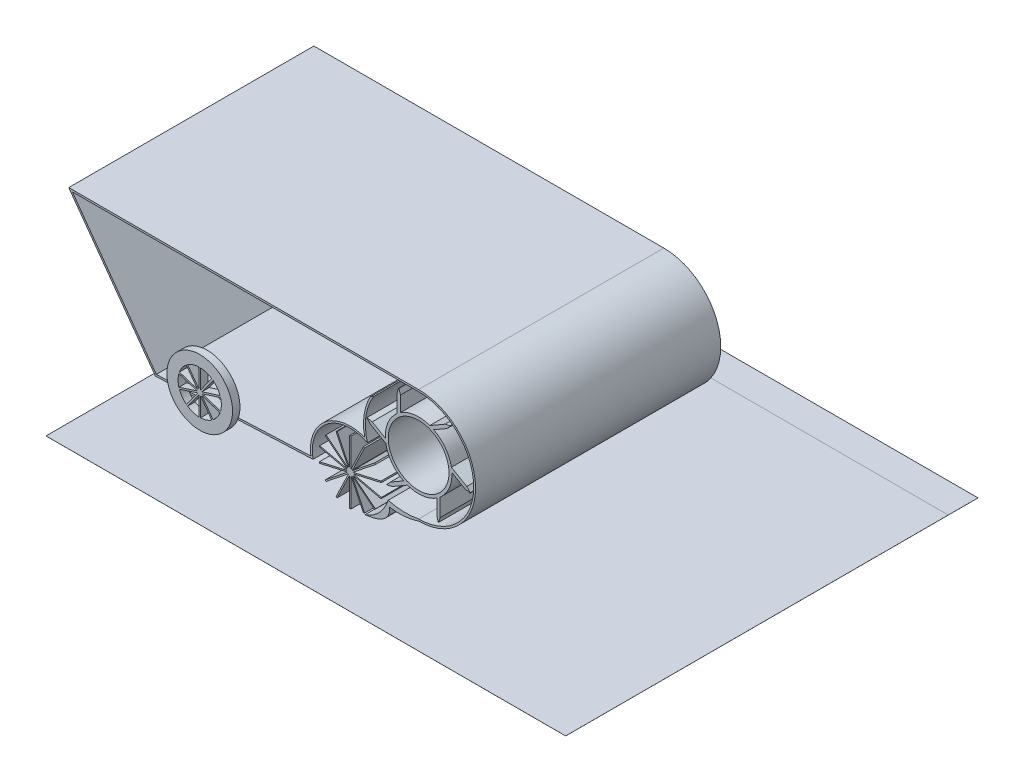
from build123d import *
from build123d.topology import SkipClean

# Parameters (mm, degrees)
BOSS_EXTRUDE1_DEPTH      = 65
SKETCH1_R                = 8.504839871
BOSS_EXTRUDE1_2_DEPTH    = 65
BOSS_EXTRUDE1_3_DEPTH    = 65
SKETCH1_R_2              = 14
BOSS_EXTRUDE1_4_DEPTH    = 65
SKETCH2_R                = 8.840643749
BOSS_EXTRUDE2_DEPTH      = 2
BOSS_EXTRUDE4_START      = 1
BOSS_EXTRUDE4_DEPTH      = 1
LPATTERN2_COUNT          = 2
LPATTERN2_PITCH          = 68
CUT_EXTRUDE1_START       = -65
CUT_EXTRUDE1_DEPTH       = 65
CUT_EXTRUDE7_START       = -65
CUT_EXTRUDE7_DEPTH       = 65
BOSS_EXTRUDE5_DEPTH      = 24
BOSS_EXTRUDE5_DEPTH_BACK = 79
SKETCH7_W                = 139.893797987
SKETCH7_H                = 0.01
SKETCH8_R                = 8.966255543
BOSS_EXTRUDE6_DEPTH      = 65
SKETCH9_R                = 8.174403451
CUT_EXTRUDE8_DEPTH       = 65
BOSS_EXTRUDE9_DEPTH      = 69
BOSS_EXTRUDE9_DEPTH_BACK = 22


with BuildPart() as part:
    # Sketch1 → Boss-Extrude1 (new body)
    with BuildSketch(Plane.XY):
        with BuildLine():
            ThreePointArc((-17.906870328, 18.531590113), (-28.480107725, 16.903769153), (-32.409642579, 6.953799004))
            Line((-32.409642579, 6.953799004), (-74.016578716, 5.184721568))
            Line((-74.016578716, 5.184721568), (-96.612999837, 36.459014216))
            Line((-96.612999837, 36.459014216), (-3.402015231, 36.459014216))
            ThreePointArc((-3.402015231, 36.459014216), (11.429545435, 21.62745355), (-3.402015231, 6.795892884))
            add(Edge.make_bspline(
                [(-11.616963472, 7.038658703), (-7.573695669, 5.998539104), (-3.402015231, 6.795892884)],
                knots=[0, 0, 0, 1, 1, 1], degree=2))
            add(Edge.make_bspline(
                [(-17.830159316, 0.566712563), (-13.289143095, 2.179337105), (-11.616963472, 7.038658703)],
                knots=[0, 0, 0, 1, 1, 1], degree=2))
            add(Edge.make_bspline(
                [(-17.830159316, 0.566712563), (-13.144144962, 1.095751607), (-10.950814866, 2.792448163), (-11.250167045, 5.656783258)],
                knots=[0, 0, 0, 0, 0.910766235, 0.910766235, 0.910766235, 0.910766235], degree=3))
            add(Edge.make_bspline(
                [(-11.250167045, 5.656783258), (-7.302874817, 4.995855134), (-3.409462759, 6.295894693)],
                knots=[0, 0, 0, 1, 1, 1], degree=2))
            ThreePointArc((-3.409462759, 6.295894693), (11.929544982, 21.623729786), (-3.402015231, 36.959014216))
            Line((-3.402015231, 36.959014216), (-97.591116803, 36.959014216))
            Line((-97.591116803, 36.959014216), (-74.264237184, 4.673739667))
            Line((-74.264237184, 4.673739667), (-31.819790944, 6.478427036))
            ThreePointArc((-31.819790944, 6.478427036), (-27.993437475, 16.649430984), (-17.173651213, 17.66063196))
            ThreePointArc((-17.173651213, 17.66063196), (-17.591195584, 23.642594253), (-15.524643386, 29.271766321))
            Line((-15.524643386, 29.271766321), (-16.399476015, 28.771766321))
            ThreePointArc((-16.399476015, 28.771766321), (-18.075448602, 23.787440797), (-17.906870328, 18.531590113))
        make_face()
    extrude(amount=BOSS_EXTRUDE1_DEPTH)

    # Sketch2 → Boss-Extrude2 (add)
    with BuildSketch(Plane.XY.offset(65)):
        with Locations((-60.327231595, 8.840643749)):
            Circle(SKETCH2_R)
        with BuildLine():
            Line((-65.802258736, 6.836721981), (-60.887402964, 8.433655426))
            Line((-60.887402964, 8.433655426), (-63.924950881, 4.25282939))
            ThreePointArc((-63.924950881, 4.25282939), (-65.043989715, 5.41371838), (-65.802258736, 6.836721981))
        make_face(mode=Mode.SUBTRACT)
        with BuildLine():
            Line((-63.578745936, 4.001296774), (-60.541198018, 8.18212281))
            Line((-60.541198018, 8.18212281), (-60.541198018, 3.014337627))
            ThreePointArc((-60.541198018, 3.014337627), (-62.12887288, 3.295762025), (-63.578745936, 4.001296774))
        make_face(mode=Mode.SUBTRACT)
        with BuildLine():
            Line((-60.113265172, 3.014337627), (-60.113265172, 8.18212281))
            Line((-60.113265172, 8.18212281), (-57.075717254, 4.001296774))
            ThreePointArc((-57.075717254, 4.001296774), (-58.52559031, 3.295762025), (-60.113265172, 3.014337627))
        make_face(mode=Mode.SUBTRACT)
        with BuildLine():
            Line((-56.729512309, 4.25282939), (-59.767060226, 8.433655426))
            Line((-59.767060226, 8.433655426), (-54.852204454, 6.836721981))
            ThreePointArc((-54.852204454, 6.836721981), (-55.610473475, 5.41371838), (-56.729512309, 4.25282939))
        make_face(mode=Mode.SUBTRACT)
        with BuildLine():
            Line((-54.719965932, 7.243710304), (-59.634821704, 8.840643749))
            Line((-59.634821704, 8.840643749), (-54.719965932, 10.437577193))
            ThreePointArc((-54.719965932, 10.437577193), (-54.496997925, 8.840643749), (-54.719965932, 7.243710304))
        make_face(mode=Mode.SUBTRACT)
        with BuildLine():
            Line((-65.934497259, 10.437577193), (-61.019641486, 8.840643749))
            Line((-61.019641486, 8.840643749), (-65.934497259, 7.243710304))
            ThreePointArc((-65.934497259, 7.243710304), (-66.157465265, 8.840643749), (-65.934497259, 10.437577193))
        make_face(mode=Mode.SUBTRACT)
        with BuildLine():
            Line((-63.924950881, 13.428458107), (-60.887402964, 9.247632071))
            Line((-60.887402964, 9.247632071), (-65.802258736, 10.844565516))
            ThreePointArc((-65.802258736, 10.844565516), (-65.043989715, 12.267569117), (-63.924950881, 13.428458107))
        make_face(mode=Mode.SUBTRACT)
        with BuildLine():
            Line((-60.541198018, 14.66694987), (-60.541198018, 9.499164687))
            Line((-60.541198018, 9.499164687), (-63.578745936, 13.679990723))
            ThreePointArc((-63.578745936, 13.679990723), (-62.12887288, 14.385525472), (-60.541198018, 14.66694987))
        make_face(mode=Mode.SUBTRACT)
        with BuildLine():
            Line((-59.767060226, 9.247632071), (-56.729512309, 13.428458107))
            ThreePointArc((-56.729512309, 13.428458107), (-55.610473475, 12.267569117), (-54.852204454, 10.844565516))
            Line((-54.852204454, 10.844565516), (-59.767060226, 9.247632071))
        make_face(mode=Mode.SUBTRACT)
        with BuildLine():
            Line((-57.075717254, 13.679990723), (-60.113265172, 9.499164687))
            Line((-60.113265172, 9.499164687), (-60.113265172, 14.66694987))
            ThreePointArc((-60.113265172, 14.66694987), (-58.52559031, 14.385525472), (-57.075717254, 13.679990723))
        make_face(mode=Mode.SUBTRACT)
    boss_extrude2 = extrude(amount=BOSS_EXTRUDE2_DEPTH)



with BuildPart() as body_2:
    # Sketch1 → Boss-Extrude1 2 (new body)
    with BuildSketch(Plane.XY):
        with Locations((-21.775110426, 8.504839871)):
            Circle(SKETCH1_R)
    extrude(amount=BOSS_EXTRUDE1_2_DEPTH)


with BuildPart() as body_3:
    # Sketch1 → Boss-Extrude1 3 (new body)
    with BuildSketch(Plane.XY):
        Polygon((-21.775110426, 0), (-79.709435336, 0), (-79.709435336, -0.01), (60.184362651, -0.01), (60.184362651, 0), align=None)
    extrude(amount=BOSS_EXTRUDE1_3_DEPTH)

    # Sketch7 → Boss-Extrude5 (add, two sides: drawn at the far end of the back side and taken through both)
    with BuildSketch(Plane.XY.offset(65).offset(-BOSS_EXTRUDE5_DEPTH_BACK)):
        with Locations((-9.762536342, -0.005)):
            Rectangle(SKETCH7_W, SKETCH7_H)
    extrude(amount=BOSS_EXTRUDE5_DEPTH + BOSS_EXTRUDE5_DEPTH_BACK)


with BuildPart() as body_4:
    # Sketch1 → Boss-Extrude1 4 (new body)
    with BuildSketch(Plane.XY):
        with Locations((-3.402015231, 21.62745355)):
            Circle(SKETCH1_R_2)
    extrude(amount=BOSS_EXTRUDE1_4_DEPTH)


with BuildPart() as part_1:
    with SkipClean():  # the faces are left unmerged after this step: merging them gives an invalid solid
        add(part.part)

        add(body_2.part)  # Boss-Extrude4 merges body 2

        add(body_4.part)  # Boss-Extrude4 merges body 4
        # Sketch3 → Boss-Extrude4 (add)
        with BuildSketch(Plane(origin=(0, 0, 0), x_dir=(-1, 0, 0), z_dir=(0, 0, -1)).offset(BOSS_EXTRUDE4_START)):
            with BuildLine():
                Line((74.264237184, 4.673739667), (97.591116803, 36.959014216))
                Line((97.591116803, 36.959014216), (3.402015231, 36.959014216))
                ThreePointArc((3.402015231, 36.959014216), (-11.929544982, 21.623729786), (3.409462759, 6.295894693))
                add(Edge.make_bspline(
                    [(11.250167045, 5.656783258), (7.302874817, 4.995855134), (3.409462759, 6.295894693)],
                    knots=[0, 0, 0, 1, 1, 1], degree=2))
                ThreePointArc((11.250167045, 5.656783258), (10.915878669, 7.523542115), (10.910103984, 9.419987212))
                ThreePointArc((10.910103984, 9.419987212), (14.811823628, 12.955089197), (17.173651213, 17.66063196))
                ThreePointArc((17.173651213, 17.66063196), (27.993437475, 16.649430984), (31.819790944, 6.478427036))
                Line((31.819790944, 6.478427036), (74.264237184, 4.673739667))
            make_face()
        extrude(amount=-BOSS_EXTRUDE4_DEPTH)

    # LPattern2: Boss-Extrude2 ×2
    with SkipClean():  # the faces are left unmerged after this step: merging them gives an invalid solid
        with Locations(*[(0, 0, -i * LPATTERN2_PITCH) for i in range(1, LPATTERN2_COUNT)]):
            add(boss_extrude2)

    # Sketch4 → Cut-Extrude1 (cut)
    with SkipClean():  # the faces are left unmerged after this step: merging them gives an invalid solid
        with BuildSketch(Plane.XY.offset(65).offset(CUT_EXTRUDE1_START)):
            with BuildLine():
                Line((-8.294836048, 33.233811721), (-8.294836048, 24.76966974))
                ThreePointArc((-8.294836048, 24.76966974), (-7.4154373, 25.835263126), (-6.309471943, 26.663316296))
                Line((-6.309471943, 26.663316296), (3.741929078, 32.466495382))
                Line((3.741929078, 32.466495382), (5.066202683, 32.775964005))
                ThreePointArc((5.066202683, 32.775964005), (-1.577863927, 35.508104544), (-8.702242726, 34.585369606))
                Line((-8.702242726, 34.585369606), (-8.294836048, 33.233811721))
            make_face()
            with BuildLine():
                Line((-9.216928656, 33.233811721), (-8.822799542, 34.535400616))
                ThreePointArc((-8.822799542, 34.535400616), (-14.510935961, 30.147540417), (-17.274013463, 23.516279921))
                Line((-17.274013463, 23.516279921), (-15.899826661, 23.193325512))
                Line((-15.899826661, 23.193325512), (-8.569664684, 18.961254521))
                ThreePointArc((-8.569664684, 18.961254521), (-9.052796253, 20.25563287), (-9.216928656, 21.62745355))
                Line((-9.216928656, 21.62745355), (-9.216928656, 33.233811721))
            make_face()
            with BuildLine():
                ThreePointArc((10.486986994, 19.868016939), (9.531056803, 26.988017677), (5.169755505, 32.696543234))
                Line((5.169755505, 32.696543234), (4.202975382, 31.667939759))
                Line((4.202975382, 31.667939759), (-3.127186595, 27.435868769))
                ThreePointArc((-3.127186595, 27.435868769), (-1.764656279, 27.207083806), (-0.494558519, 26.663316296))
                Line((-0.494558519, 26.663316296), (9.556842502, 20.860137211))
                Line((9.556842502, 20.860137211), (10.486986994, 19.868016939))
            make_face()
            with BuildLine():
                Line((-16.360872965, 22.39476989), (-17.291017457, 23.386890161))
                ThreePointArc((-17.291017457, 23.386890161), (-16.335087266, 16.266889423), (-11.973785968, 10.558363866))
                Line((-11.973785968, 10.558363866), (-11.007005844, 11.586967341))
                Line((-11.007005844, 11.586967341), (-3.676843867, 15.819038332))
                ThreePointArc((-3.676843867, 15.819038332), (-5.039374184, 16.047823294), (-6.309471943, 16.591590804))
                Line((-6.309471943, 16.591590804), (-16.360872965, 22.39476989))
            make_face()
            with BuildLine():
                ThreePointArc((2.018769079, 8.719506484), (7.706905498, 13.107366683), (10.469983, 19.738627179))
                Line((10.469983, 19.738627179), (9.095796199, 20.061581588))
                Line((9.095796199, 20.061581588), (1.765634222, 24.293652579))
                ThreePointArc((1.765634222, 24.293652579), (2.24876579, 22.99927423), (2.412898193, 21.62745355))
                Line((2.412898193, 21.62745355), (2.412898193, 10.021095379))
                Line((2.412898193, 10.021095379), (2.018769079, 8.719506484))
            make_face()
            with BuildLine():
                Line((-10.545959541, 10.788411718), (-11.870233146, 10.478943096))
                ThreePointArc((-11.870233146, 10.478943096), (-5.226166536, 7.746802556), (1.898212264, 8.669537495))
                Line((1.898212264, 8.669537495), (1.490805586, 10.021095379))
                Line((1.490805586, 10.021095379), (1.490805586, 18.48523736))
                ThreePointArc((1.490805586, 18.48523736), (0.611406838, 17.419643974), (-0.494558519, 16.591590804))
                Line((-0.494558519, 16.591590804), (-10.545959541, 10.788411718))
            make_face()
        extrude(amount=CUT_EXTRUDE1_DEPTH, mode=Mode.SUBTRACT)

    # Sketch5 → Cut-Extrude7 (cut)
    with SkipClean():  # the faces are left unmerged after this step: merging them gives an invalid solid
        with BuildSketch(Plane.XY.offset(65).offset(CUT_EXTRUDE7_START)):
            with BuildLine():
                Line((-21.602125647, 17.007920342), (-21.602125647, 9.436466711))
                ThreePointArc((-21.602125647, 9.436466711), (-21.564260563, 9.428633483), (-21.52674659, 9.419261933))
                Line((-21.52674659, 9.419261933), (-18.241615978, 16.240905939))
                ThreePointArc((-18.241615978, 16.240905939), (-19.882605515, 16.79644565), (-21.602125647, 17.007920342))
            make_face()
            with BuildLine():
                Line((-21.948095206, 9.436466711), (-21.948095206, 17.007920342))
                ThreePointArc((-21.948095206, 17.007920342), (-23.667615338, 16.79644565), (-25.308604874, 16.240905939))
                Line((-25.308604874, 16.240905939), (-22.023474262, 9.419261933))
                ThreePointArc((-22.023474262, 9.419261933), (-21.98596029, 9.428633483), (-21.948095206, 9.436466711))
            make_face()
            with BuildLine():
                ThreePointArc((-15.234988662, 13.941668775), (-16.4724295, 15.154191435), (-17.929908177, 16.090795374))
                Line((-17.929908177, 16.090795374), (-21.215038789, 9.269151367))
                ThreePointArc((-21.215038789, 9.269151367), (-21.184322237, 9.245664828), (-21.154589479, 9.220944651))
                Line((-21.154589479, 9.220944651), (-15.234988662, 13.941668775))
            make_face()
            with BuildLine():
                Line((-22.335182064, 9.269151367), (-25.620312676, 16.090795374))
                ThreePointArc((-25.620312676, 16.090795374), (-27.077791352, 15.154191435), (-28.315232191, 13.941668775))
                Line((-28.315232191, 13.941668775), (-22.395631374, 9.220944651))
                ThreePointArc((-22.395631374, 9.220944651), (-22.365898616, 9.245664828), (-22.335182064, 9.269151367))
            make_face()
            with BuildLine():
                ThreePointArc((-13.52371267, 10.565600968), (-14.112514476, 12.194951595), (-15.01928017, 13.671178882))
                Line((-15.01928017, 13.671178882), (-20.938880987, 8.950454758))
                ThreePointArc((-20.938880987, 8.950454758), (-20.921396757, 8.915966706), (-20.905334151, 8.880794035))
                Line((-20.905334151, 8.880794035), (-13.52371267, 10.565600968))
            make_face()
            with BuildLine():
                Line((-22.611339865, 8.950454758), (-28.530940682, 13.671178882))
                ThreePointArc((-28.530940682, 13.671178882), (-29.437706376, 12.194951595), (-30.026508182, 10.565600968))
                Line((-30.026508182, 10.565600968), (-22.644886702, 8.880794035))
                ThreePointArc((-22.644886702, 8.880794035), (-22.628824095, 8.915966706), (-22.611339865, 8.950454758))
            make_face()
            with BuildLine():
                ThreePointArc((-13.446727201, 6.781374153), (-13.270270555, 8.504839871), (-13.446727201, 10.228305589))
                Line((-13.446727201, 10.228305589), (-20.828348682, 8.543498656))
                ThreePointArc((-20.828348682, 8.543498656), (-20.82755974, 8.504839871), (-20.828348682, 8.466181086))
                Line((-20.828348682, 8.466181086), (-13.446727201, 6.781374153))
            make_face()
            with BuildLine():
                Line((-22.721872171, 8.543498656), (-30.103493652, 10.228305589))
                ThreePointArc((-30.103493652, 10.228305589), (-30.279950297, 8.504839871), (-30.103493652, 6.781374153))
                Line((-30.103493652, 6.781374153), (-22.721872171, 8.466181086))
                ThreePointArc((-22.721872171, 8.466181086), (-22.722661112, 8.504839871), (-22.721872171, 8.543498656))
            make_face()
            with BuildLine():
                ThreePointArc((-15.01928017, 3.338500859), (-14.112514476, 4.814728147), (-13.52371267, 6.444078773))
                Line((-13.52371267, 6.444078773), (-20.905334151, 8.128885707))
                ThreePointArc((-20.905334151, 8.128885707), (-20.921396757, 8.093713036), (-20.938880987, 8.059224983))
                Line((-20.938880987, 8.059224983), (-15.01928017, 3.338500859))
            make_face()
            with BuildLine():
                Line((-22.644886702, 8.128885707), (-30.026508182, 6.444078773))
                ThreePointArc((-30.026508182, 6.444078773), (-29.437706376, 4.814728147), (-28.530940682, 3.338500859))
                Line((-28.530940682, 3.338500859), (-22.611339865, 8.059224983))
                ThreePointArc((-22.611339865, 8.059224983), (-22.628824095, 8.093713036), (-22.644886702, 8.128885707))
            make_face()
            with BuildLine():
                ThreePointArc((-17.929908177, 0.918884368), (-16.4724295, 1.855488306), (-15.234988662, 3.068010966))
                Line((-15.234988662, 3.068010966), (-21.154589479, 7.788735091))
                ThreePointArc((-21.154589479, 7.788735091), (-21.184322237, 7.764014913), (-21.215038789, 7.740528374))
                Line((-21.215038789, 7.740528374), (-17.929908177, 0.918884368))
            make_face()
            with BuildLine():
                Line((-22.395631374, 7.788735091), (-28.315232191, 3.068010966))
                ThreePointArc((-28.315232191, 3.068010966), (-27.077791352, 1.855488306), (-25.620312676, 0.918884368))
                Line((-25.620312676, 0.918884368), (-22.335182064, 7.740528374))
                ThreePointArc((-22.335182064, 7.740528374), (-22.365898616, 7.764014913), (-22.395631374, 7.788735091))
            make_face()
            with BuildLine():
                ThreePointArc((-21.602125647, 0.0017594), (-19.882605515, 0.213234092), (-18.241615978, 0.768773802))
                Line((-18.241615978, 0.768773802), (-21.52674659, 7.590417809))
                ThreePointArc((-21.52674659, 7.590417809), (-21.564260563, 7.581046259), (-21.602125647, 7.573213031))
                Line((-21.602125647, 7.573213031), (-21.602125647, 0.0017594))
            make_face()
            with BuildLine():
                Line((-22.023474262, 7.590417809), (-25.308604874, 0.768773802))
                ThreePointArc((-25.308604874, 0.768773802), (-23.667615338, 0.213234092), (-21.948095206, 0.0017594))
                Line((-21.948095206, 0.0017594), (-21.948095206, 7.573213031))
                ThreePointArc((-21.948095206, 7.573213031), (-21.98596029, 7.581046259), (-22.023474262, 7.590417809))
            make_face()
        extrude(amount=CUT_EXTRUDE7_DEPTH, mode=Mode.SUBTRACT)

    # Sketch8 → Boss-Extrude6 (add)
    with SkipClean():  # the faces are left unmerged after this step: merging them gives an invalid solid
        with BuildSketch(Plane.XY.offset(65)):
            with Locations((-3.402015231, 21.62745355)):
                Circle(SKETCH8_R)
        extrude(amount=-BOSS_EXTRUDE6_DEPTH)

    # Sketch9 → Cut-Extrude8 (cut)
    with SkipClean():  # the faces are left unmerged after this step: merging them gives an invalid solid
        with BuildSketch(Plane.XY.offset(65)):
            with Locations((-3.402015231, 21.62745355)):
                Circle(SKETCH9_R)
        extrude(amount=-CUT_EXTRUDE8_DEPTH, mode=Mode.SUBTRACT)


with BuildPart() as body_3_2:
    # Sketch1<3> → Boss-Extrude9 (new, two sides: drawn at the far end of the back side and taken through both)
    with BuildSketch(Plane.XY.offset(-BOSS_EXTRUDE9_DEPTH_BACK)):
        Polygon((-21.775110426, 0), (-79.709435336, 0), (-79.709435336, -0.01), (60.184362651, -0.01), (60.184362651, 0), align=None)
    extrude(amount=BOSS_EXTRUDE9_DEPTH + BOSS_EXTRUDE9_DEPTH_BACK)


solid = Compound([body_3.part, part_1.part, body_3_2.part])
